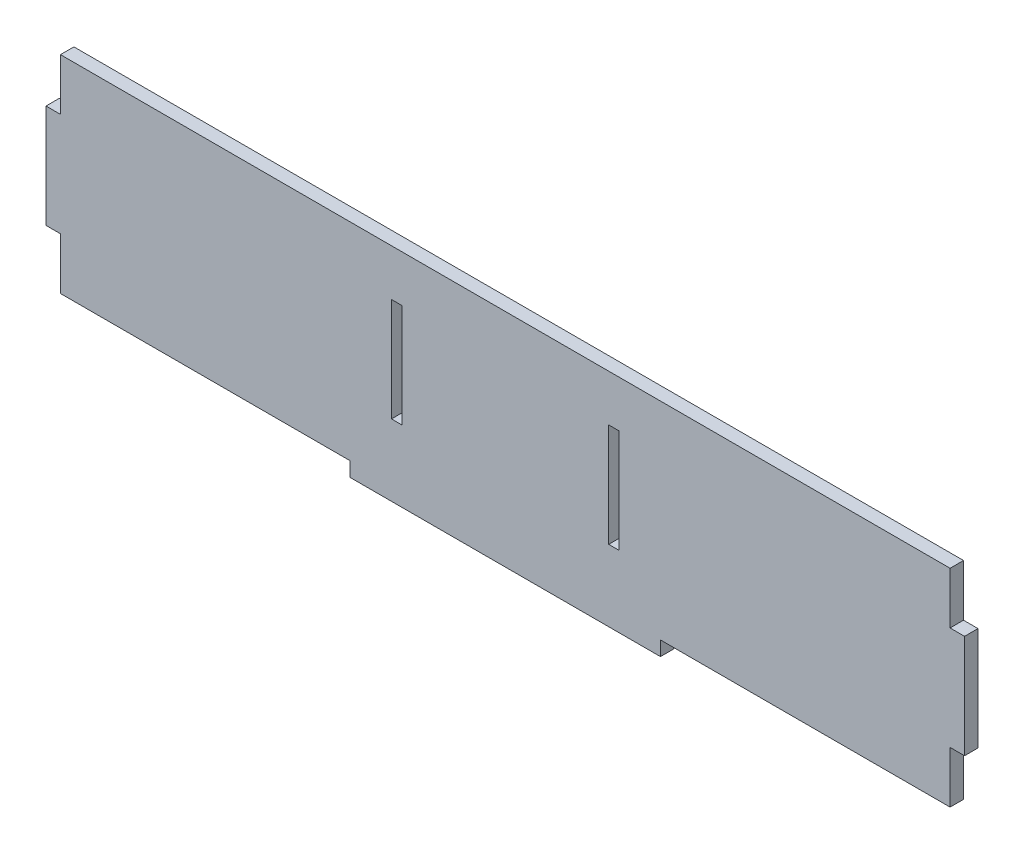
from build123d import *

# Parameters (mm, degrees)
SKETCH1_W           = 86
SKETCH1_H           = 20
BOSS_EXTRUDE1_DEPTH = 1.3
SKETCH2_W           = 30
SKETCH2_H           = 1.4
SKETCH2_W_2         = 1.4
SKETCH2_H_2         = 10
BOSS_EXTRUDE2_DEPTH = 1.3
SKETCH3_W           = 1
SKETCH3_H           = 10
CUT_EXTRUDE1_DEPTH  = 46.858586982


with BuildPart() as part:
    # Sketch1 → Boss-Extrude1 (new body)
    with BuildSketch(Plane.XY):
        Rectangle(SKETCH1_W, SKETCH1_H)
    extrude(amount=BOSS_EXTRUDE1_DEPTH)

    # Sketch2 → Boss-Extrude2 (add)
    with BuildSketch(Plane.XY.offset(1.3)):
        with Locations((0, -10.7)):
            Rectangle(SKETCH2_W, SKETCH2_H)
        with Locations((-43.7, 0)):
            Rectangle(SKETCH2_W_2, SKETCH2_H_2)
        with Locations((43.7, 0)):
            Rectangle(SKETCH2_W_2, SKETCH2_H_2)
    extrude(amount=-BOSS_EXTRUDE2_DEPTH)

    # Sketch3 → Cut-Extrude1 (cut, through all)
    with BuildSketch(Plane.XY.offset(1.3)):
        with Locations((-10.5, 0.5)):
            Rectangle(SKETCH3_W, SKETCH3_H)
        with Locations((10.5, 0.5)):
            Rectangle(SKETCH3_W, SKETCH3_H)
    extrude(amount=-CUT_EXTRUDE1_DEPTH, mode=Mode.SUBTRACT)


solid = part.part
